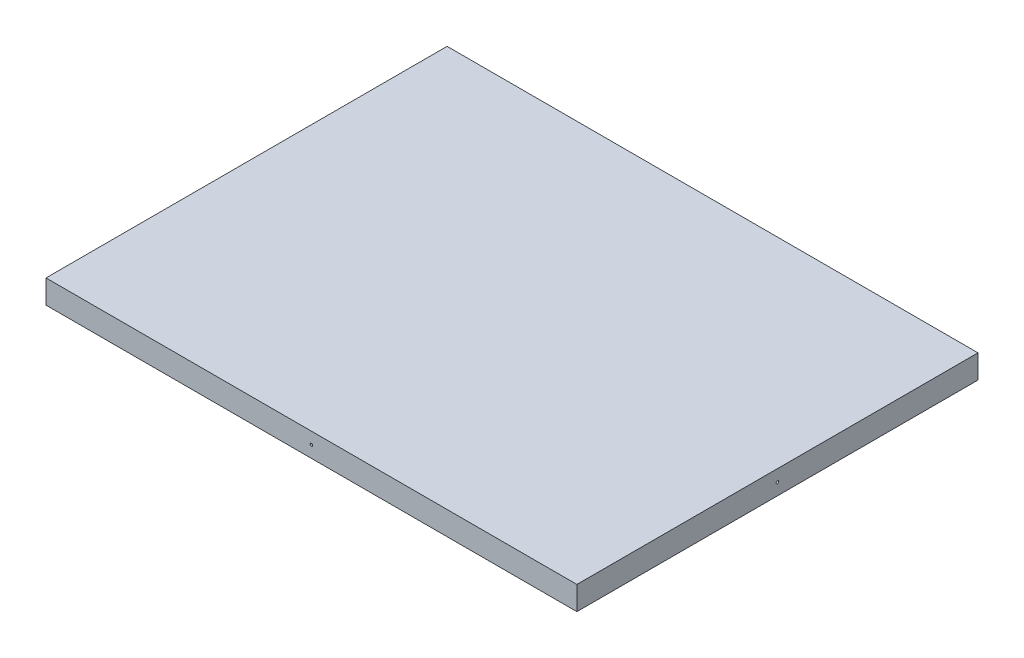
from build123d import *

# Parameters (mm, degrees)
SKETCH_1_W         = 900
SKETCH_1_H         = 680
EXTRUDE_1_DEPTH    = 40
HOLE_WIZARD_M5_1_D = 4.2
HOLE_WIZARD_M5_2_D = 4.2


with BuildPart() as part:
    # 草图1 → 凸台-拉伸1 (new body)
    with BuildSketch(Plane(origin=(0, 0, 0), x_dir=(1, 0, 0), z_dir=(0, 1, 0))):
        Rectangle(SKETCH_1_W, SKETCH_1_H)
    extrude(amount=EXTRUDE_1_DEPTH)

    # M5 螺纹孔1 (through all)
    with Locations(Plane.XY.offset(340)):
        with Locations((0, 20)):
            Hole(HOLE_WIZARD_M5_1_D / 2)

    # M5 螺纹孔2 (through all)
    with Locations(Plane.ZY.offset(450)):
        with Locations((0, 20)):
            Hole(HOLE_WIZARD_M5_2_D / 2)


solid = part.part
